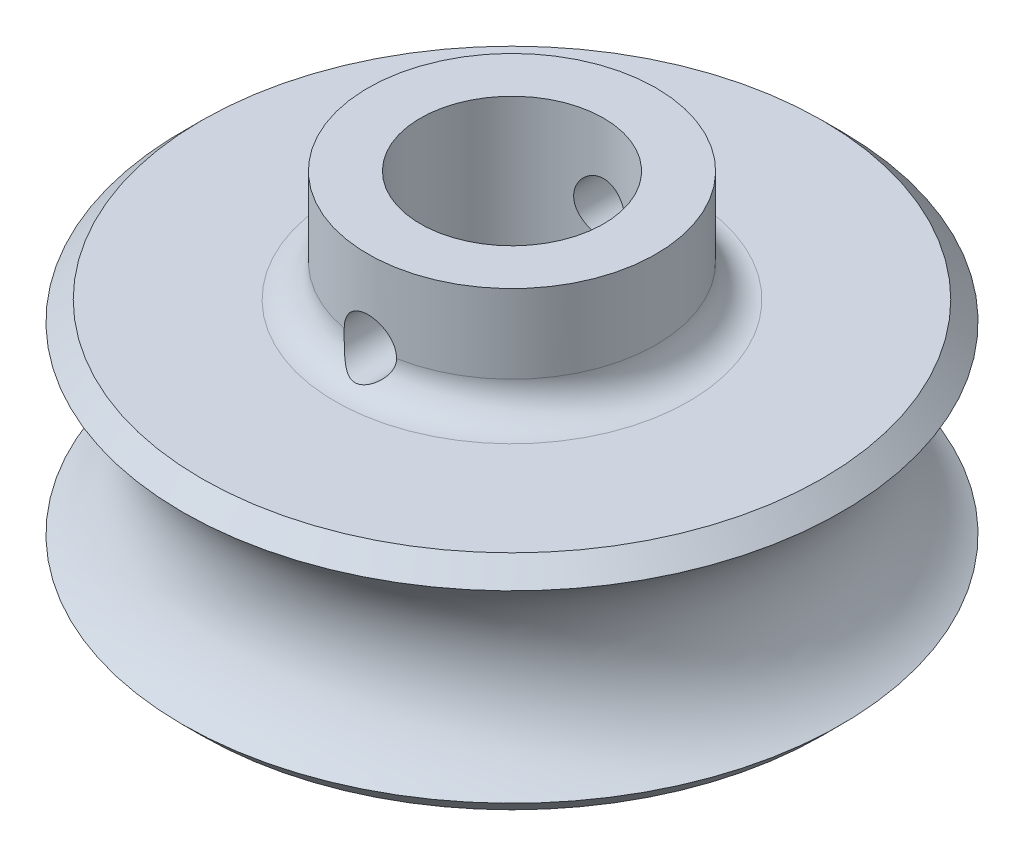
from build123d import *

# Parameters (mm, degrees)
CUT_EXTRUDE1_REACH             = 23.896
SKETCH2_R                      = 1
CUT_EXTRUDE1_DIRECTION_2_REACH = 23.896


with BuildPart() as part:
    # Sketch1 → Revolve1 (revolve)
    with BuildSketch(Plane.XY, mode=Mode.PRIVATE) as revolve1_sk:
        with BuildLine():
            Line((3.5, 8.5), (3.5, 0))
            Line((3.5, 0), (11.85, 0))
            Line((11.85, 0), (12.587068007, 0.737068007))
            ThreePointArc((12.587068007, 0.737068007), (10.5, 4.25), (12.587068007, 7.762931993))
            Line((12.587068007, 7.762931993), (11.85, 8.5))
            Line((11.85, 8.5), (6.75, 8.5))
            ThreePointArc((6.75, 8.5), (5.866116524, 8.866116524), (5.5, 9.75))
            Line((5.5, 9.75), (5.5, 12.75))
            Line((5.5, 12.75), (3.5, 12.75))
            Line((3.5, 12.75), (3.5, 8.5))
        make_face()
    revolve(revolve1_sk.sketch.rotate(Axis((0, 0, 0), (0, 1, 0)), 90), axis=Axis((0, 0, 0), (0, 1, 0)))

    # Sketch2 → Cut-Extrude1 (cut, up to next)
    with BuildSketch(Plane.XY, mode=Mode.PRIVATE) as cut_extrude1_sk1:
        with Locations((0, 9.75)):
            Circle(SKETCH2_R)
    cut_extrude1_tool1 = extrude(cut_extrude1_sk1.sketch, amount=-CUT_EXTRUDE1_REACH, mode=Mode.PRIVATE) & part.part
    add(cut_extrude1_tool1.solids().sort_by_distance((0, 9.75, 0))[0], mode=Mode.SUBTRACT)

    # Sketch2 → Cut-Extrude1 direction 2 (cut, up to next)
    with BuildSketch(Plane.XY, mode=Mode.PRIVATE) as cut_extrude1_direction_2_sk1:
        with Locations((0, 9.75)):
            Circle(SKETCH2_R)
    cut_extrude1_direction_2_tool1 = extrude(cut_extrude1_direction_2_sk1.sketch, amount=CUT_EXTRUDE1_DIRECTION_2_REACH, mode=Mode.PRIVATE) & part.part
    add(cut_extrude1_direction_2_tool1.solids().sort_by_distance((0, 9.75, 0))[0], mode=Mode.SUBTRACT)


solid = part.part
